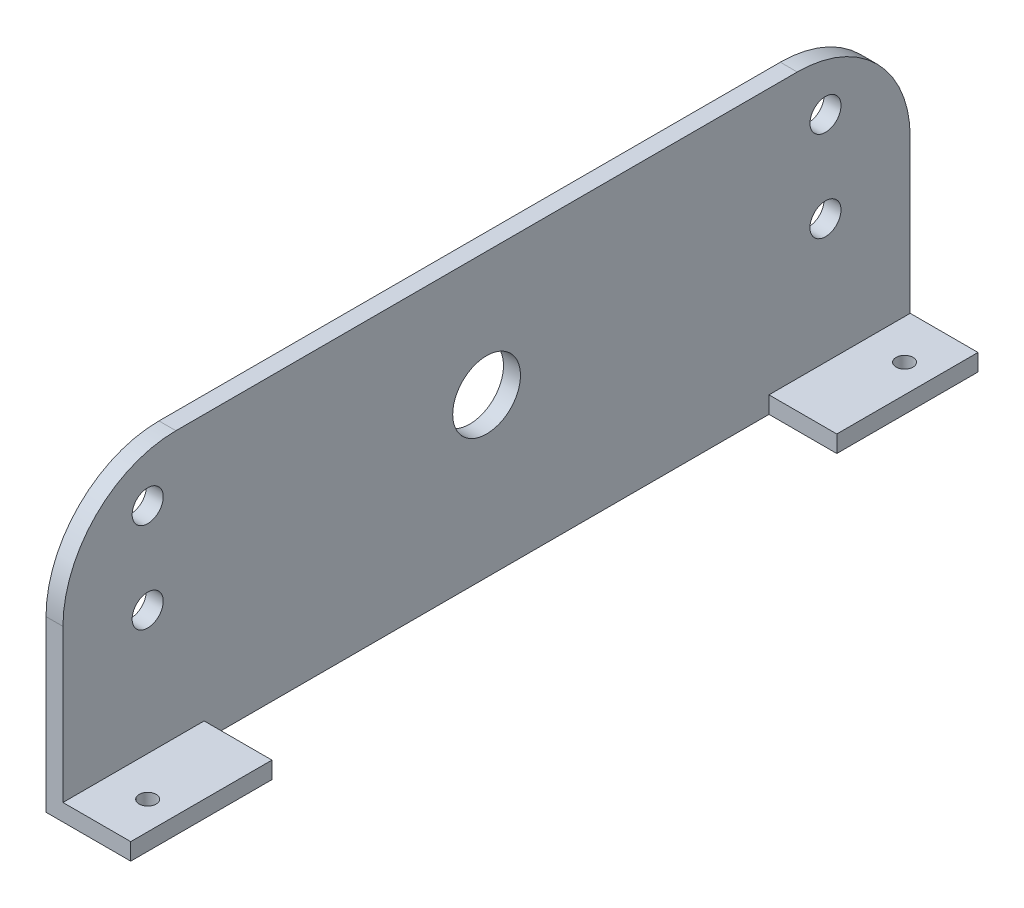
from build123d import *

# Parameters (mm, degrees)
SKETCH_1_W                  = 50
SKETCH_1_H                  = 150
EXTRUDE_1_DEPTH             = 3
SKETCH_2_W                  = 25
SKETCH_2_H                  = 3
EXTRUDE_2_DEPTH             = 12
SKETCH_3_W                  = 25
SKETCH_3_H                  = 3
EXTRUDE_3_DEPTH             = 12
HOLE_WIZARD_3_0_3_1_D       = 3
HOLE_WIZARD_3_0_3_1_DEPTH   = 50.000025
HOLE_WIZARD_5_5_5_5_1_D     = 5.5
HOLE_WIZARD_12_0_12_1_D     = 12
HOLE_WIZARD_12_0_12_1_DEPTH = 15.000025
FILLET_1_R                  = 20


with BuildPart() as part:
    # ｽｹｯﾁ1 → ﾎﾞｽ - 押し出し1 (new body)
    with BuildSketch(Plane(origin=(0, 0, 0), x_dir=(0, -1, 0), z_dir=(-1, 0, 0))):
        with Locations((-25, 0)):
            Rectangle(SKETCH_1_W, SKETCH_1_H)
    extrude(amount=-EXTRUDE_1_DEPTH)

    # ｽｹｯﾁ2 → ﾎﾞｽ - 押し出し2 (add)
    with BuildSketch(Plane(origin=(3, 0, 0), x_dir=(0, 0, -1), z_dir=(1, 0, 0))):
        with Locations((-62.5, 1.5)):
            Rectangle(SKETCH_2_W, SKETCH_2_H)
    extrude(amount=EXTRUDE_2_DEPTH)

    # ｽｹｯﾁ3 → ﾎﾞｽ - 押し出し3 (add)
    with BuildSketch(Plane(origin=(3, 0, 0), x_dir=(0, 0, -1), z_dir=(1, 0, 0))):
        with Locations((62.5, 1.5)):
            Rectangle(SKETCH_3_W, SKETCH_3_H)
    extrude(amount=EXTRUDE_3_DEPTH)

    # Ø3.0 (3) 直径の穴1
    with Locations(Plane(origin=(0, 0, 0), x_dir=(-1, 0, 0), z_dir=(0, -1, 0))):
        with Locations((-10, -67), (-10, 67)):
            Hole(HOLE_WIZARD_3_0_3_1_D / 2, depth=HOLE_WIZARD_3_0_3_1_DEPTH)

    # Ø5.5 (5.5) 直径の穴1 (through all)
    with Locations(Plane(origin=(3, 0, 0), x_dir=(0, 0, -1), z_dir=(1, 0, 0))):
        with Locations((60, 41), (-60, 41), (-60, 25), (60, 25)):
            Hole(HOLE_WIZARD_5_5_5_5_1_D / 2)

    # Ø12.0 (12) 直径の穴1
    with Locations(Plane.ZY):
        with Locations((0, 28)):
            Hole(HOLE_WIZARD_12_0_12_1_D / 2, depth=HOLE_WIZARD_12_0_12_1_DEPTH)

    # ﾌｨﾚｯﾄ1
    fillet_1_edges = [part.edges().sort_by_distance(p)[0] for p in [
        (1.5, 50, -75),
        (1.5, 50, 75),
    ]]
    fillet(fillet_1_edges, radius=FILLET_1_R)


solid = part.part
